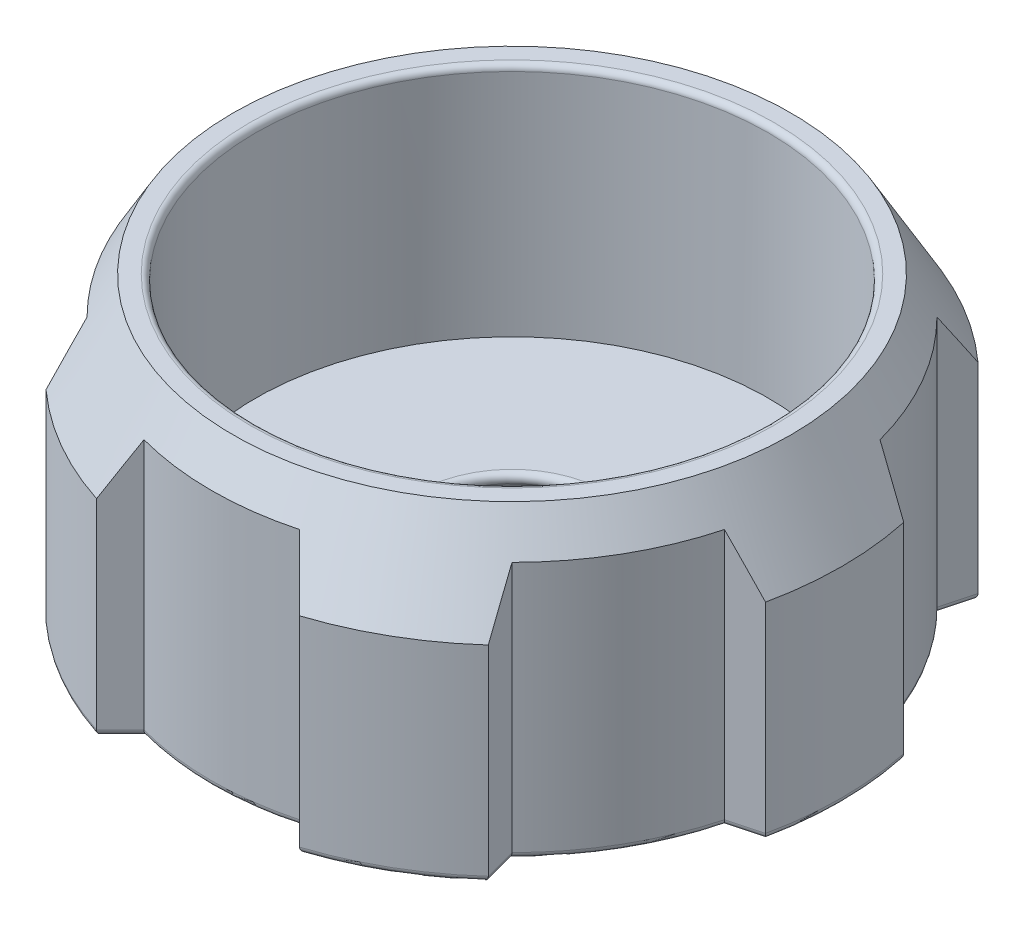
from build123d import *

# Parameters (mm, degrees)
SIDE_CUTOUT_DEPTH         = 94.658955792
SIDE_CUTOUT_PATTERN_COUNT = 6
OVERALL_FILLETS_R         = 1
SCREW_HOLE_PATTERN_COUNT  = 6


with BuildPart() as part:
    # Sketch1 → body (revolve)
    with BuildSketch(Plane.XY):
        Polygon((20, 0), (14.226497308, 10), (43.5, 10), (43.5, 50), (47.339745962, 50), (56, 35), (56, 0), align=None)
    revolve(axis=Axis((0, 0, 0), (0, 1, 0)))

    # Sketch5 → side_cutout (cut, symmetric)
    with BuildSketch(Plane.XZ):
        with BuildLine():
            Line((110.083964015, 312.314512522), (37.535126405, 41.55856453))
            Line((37.535126405, 41.55856453), (36.062445841, 36.062445841))
            ThreePointArc((36.062445841, 36.062445841), (44.167295593, 25.5), (49.262217141, 13.1997713))
            Line((49.262217141, 13.1997713), (54.75833583, 11.727090736))
            Line((54.75833583, 11.727090736), (325.514283822, -60.821746875))
            Line((325.514283822, -60.821746875), (811.02056765, 219.485436786))
            Line((811.02056765, 219.485436786), (595.590247843, 592.621696183))
            Line((595.590247843, 592.621696183), (110.083964015, 312.314512522))
        make_face()
    side_cutout = extrude(amount=SIDE_CUTOUT_DEPTH, both=True, mode=Mode.SUBTRACT)

    # side_cutout_pattern: side_cutout ×6 about axis
    side_cutout_pattern_axis = Axis((0, 0, 0), (0, -1, 0))
    for i in range(1, SIDE_CUTOUT_PATTERN_COUNT):
        add(side_cutout.rotate(side_cutout_pattern_axis, i * 360 / SIDE_CUTOUT_PATTERN_COUNT), mode=Mode.SUBTRACT)

    # overall_fillets
    overall_fillets_edges = [part.edges().sort_by_distance(p)[0] for p in [
        (56, 0, 0),
        (36.798786123, 0, -38.810505185),
        (44.167295593, 0, -25.5),
        (52.010276485, 0, -12.463431018),
        (28, 0, 48.497422612),
        (52.010276485, 0, 12.463431018),
        (44.167295593, 0, 25.5),
        (36.798786123, 0, 38.810505185),
        (-28, 0, 48.497422612),
        (15.211490363, 0, 51.273936203),
        (0, 0, 51),
        (-15.211490363, 0, 51.273936203),
        (-56, 0, 0),
        (-36.798786123, 0, 38.810505185),
        (-44.167295593, 0, 25.5),
        (-52.010276485, 0, 12.463431018),
        (-28, 0, -48.497422612),
        (-43.5, 50, 0),
        (-52.010276485, 0, -12.463431018),
        (-44.167295593, 0, -25.5),
        (-36.798786123, 0, -38.810505185),
        (-14.226497308, 10, 0),
        (28, 0, -48.497422612),
        (-20, 0, 0),
        (-15.211490363, 0, -51.273936203),
        (0, 0, -51),
        (15.211490363, 0, -51.273936203),
    ]]
    fillet(overall_fillets_edges, radius=OVERALL_FILLETS_R)

    # Sketch4 → screw_holes (revolve, cut)
    with BuildSketch(Plane(origin=(46, 0, 0), x_dir=(0, 0, -1), z_dir=(1, 0, 0))):
        Polygon((0, 0), (0, 8.811161836), (1.35, 8), (1.35, 0.3), (1.65, 0), align=None)
    screw_holes = revolve(axis=Axis((46, -6.35, 0), (0, 1, 0)), mode=Mode.SUBTRACT)

    # screw_hole_pattern: screw_holes ×6 about axis
    screw_hole_pattern_axis = Axis((0, 0, 0), (0, 1, 0))
    for i in range(1, SCREW_HOLE_PATTERN_COUNT):
        add(screw_holes.rotate(screw_hole_pattern_axis, i * 360 / SCREW_HOLE_PATTERN_COUNT), mode=Mode.SUBTRACT)


solid = part.part
